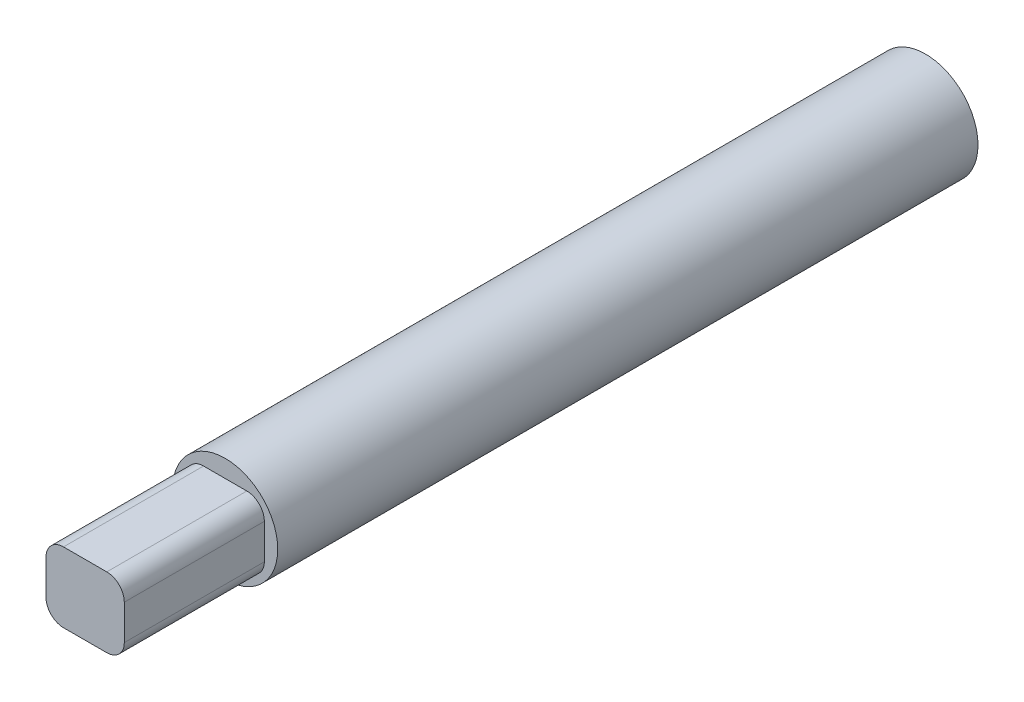
from build123d import *

# Parameters (mm, degrees)
SKETCH1_R           = 3
BOSS_EXTRUDE1_DEPTH = 40
SKETCH2_W           = 4.472135954
SKETCH2_H           = 4
BOSS_EXTRUDE2_DEPTH = 8
FILLET1_R           = 1


with BuildPart() as part:
    # Sketch1 → Boss-Extrude1 (new body)
    with BuildSketch(Plane.XY):
        Circle(SKETCH1_R)
    extrude(amount=BOSS_EXTRUDE1_DEPTH)

    # Sketch2 → Boss-Extrude2 (add)
    with BuildSketch(Plane.XY.offset(40)):
        Rectangle(SKETCH2_W, SKETCH2_H)
    extrude(amount=BOSS_EXTRUDE2_DEPTH)

    # Fillet1
    fillet1_edges = [part.edges().sort_by_distance(p)[0] for p in [
        (2.236067977, -2, 44),
        (2.236067977, 2, 44),
        (-2.236067977, 2, 44),
        (-2.236067977, -2, 44),
    ]]
    fillet(fillet1_edges, radius=FILLET1_R)


solid = part.part
